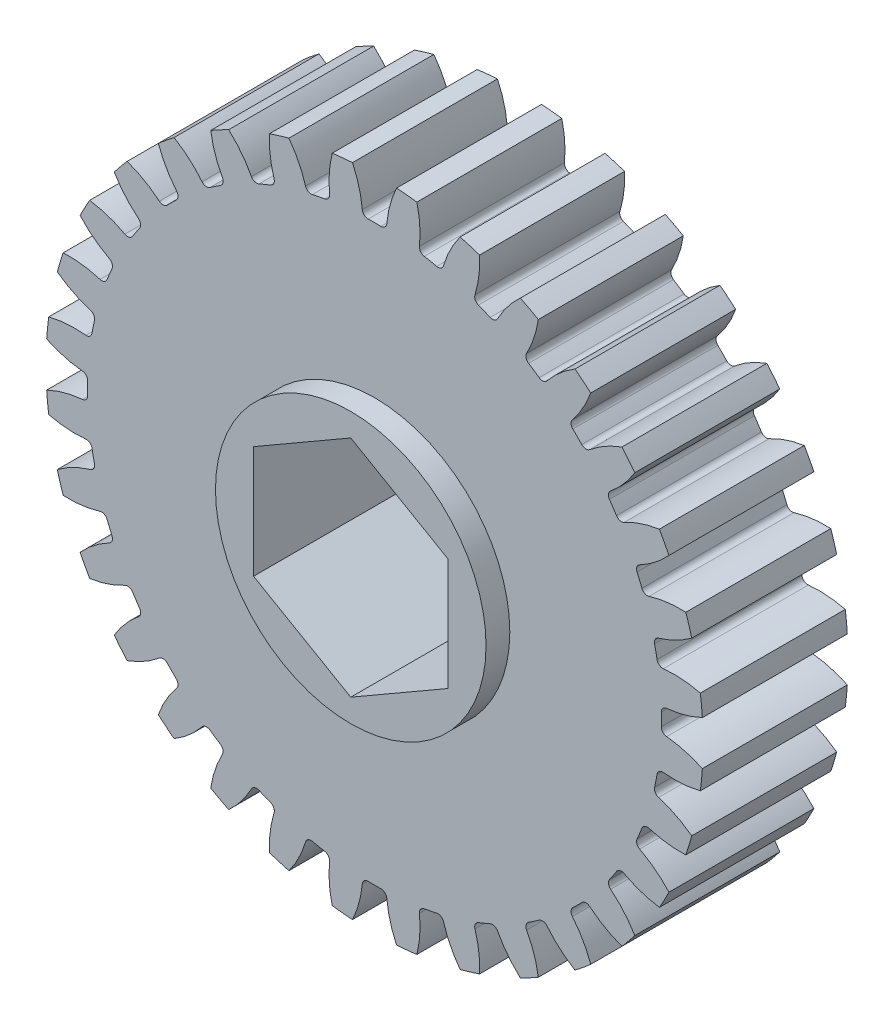
from build123d import *

# Parameters (mm, degrees)
CROQUIS1_R                 = 21.59
SALIENTE_EXTRUIR1_DEPTH    = 4.7625
CORTAR_EXTRUIR1_DEPTH      = 31.902064757
REDONDEO1_R                = 0.381028065
MATRIZC1_COUNT             = 32
REDONDEO1_OF_MATRIZC1_R    = 0.381028065
CROQUIS3_R                 = 8.89
SALIENTE_EXTRUIR2_DEPTH    = 6.3246
CORTAR_EXTRUIR2_DEPTH      = 32.113625961
CORTAR_EXTRUIR2_DEPTH_BACK = 32.113625961


with BuildPart() as part:
    # Croquis1 → Saliente-Extruir1 (new, symmetric)
    with BuildSketch(Plane.XY):
        Circle(CROQUIS1_R)
    extrude(amount=SALIENTE_EXTRUIR1_DEPTH, both=True)

    # Croquis2 → Cortar-Extruir1 (cut, symmetric)
    with BuildSketch(Plane.XY):
        with BuildLine():
            ThreePointArc((0.780357424, 18.834450872), (0, 18.85061), (-0.780357424, 18.834450872))
            ThreePointArc((-0.780357424, 18.834450872), (-0.978355848, 20.221556235), (-1.448974349, 21.54132246))
            ThreePointArc((-1.448974349, 21.54132246), (0, 21.59), (1.448974349, 21.54132246))
            ThreePointArc((1.448974349, 21.54132246), (0.978355848, 20.221556235), (0.780357424, 18.834450872))
        make_face()
    cortar_extruir1 = extrude(amount=CORTAR_EXTRUIR1_DEPTH, both=True, mode=Mode.SUBTRACT)

    # Redondeo1
    redondeo1_edges = [part.edges().sort_by_distance(p)[0] for p in [
        (0.780357424, 18.834450872, 0),
        (-0.780357424, 18.834450872, 0),
    ]]
    fillet(redondeo1_edges, radius=REDONDEO1_R)

    # MatrizC1: Cortar-Extruir1 ×32 about axis
    matrizc1_axis = Axis((0, 0, 4.7625), (0, 0, -1))
    for i in range(1, MATRIZC1_COUNT):
        add(cortar_extruir1.rotate(matrizc1_axis, i * 360 / MATRIZC1_COUNT), mode=Mode.SUBTRACT)

    # Redondeo1 of MatrizC1
    redondeo1_of_matrizc1_edges = [part.edges().sort_by_distance(p)[0] for p in [
        (4.439782161, 18.320311999, 0),
        (2.90905601, 18.624792361, 0),
        (7.928588559, 17.102133809, 0),
        (6.486676054, 17.699393525, 0),
        (11.112703745, 15.226730209, 0),
        (9.815016775, 16.093816921, 0),
        (13.869763958, 12.766171905, 0),
        (12.766171905, 13.869763958, 0),
        (16.093816921, 9.815016775, 0),
        (15.226730209, 11.112703745, 0),
        (17.699393525, 6.486676054, 0),
        (17.102133809, 7.928588559, 0),
        (18.624792361, 2.90905601, 0),
        (18.320311999, 4.439782161, 0),
        (18.834450872, -0.780357424, 0),
        (18.834450872, 0.780357424, 0),
        (18.320311999, -4.439782161, 0),
        (18.624792361, -2.90905601, 0),
        (17.102133809, -7.928588559, 0),
        (17.699393525, -6.486676054, 0),
        (15.226730209, -11.112703745, 0),
        (16.093816921, -9.815016775, 0),
        (12.766171905, -13.869763958, 0),
        (13.869763958, -12.766171905, 0),
        (9.815016775, -16.093816921, 0),
        (11.112703745, -15.226730209, 0),
        (6.486676054, -17.699393525, 0),
        (7.928588559, -17.102133809, 0),
        (2.90905601, -18.624792361, 0),
        (4.439782161, -18.320311999, 0),
        (-0.780357424, -18.834450872, 0),
        (0.780357424, -18.834450872, 0),
        (-4.439782161, -18.320311999, 0),
        (-2.90905601, -18.624792361, 0),
        (-7.928588559, -17.102133809, 0),
        (-6.486676054, -17.699393525, 0),
        (-11.112703745, -15.226730209, 0),
        (-9.815016775, -16.093816921, 0),
        (-13.869763958, -12.766171905, 0),
        (-12.766171905, -13.869763958, 0),
        (-16.093816921, -9.815016775, 0),
        (-15.226730209, -11.112703745, 0),
        (-17.699393525, -6.486676054, 0),
        (-17.102133809, -7.928588559, 0),
        (-18.624792361, -2.90905601, 0),
        (-18.320311999, -4.439782161, 0),
        (-18.834450872, 0.780357424, 0),
        (-18.834450872, -0.780357424, 0),
        (-18.320311999, 4.439782161, 0),
        (-18.624792361, 2.90905601, 0),
        (-17.102133809, 7.928588559, 0),
        (-17.699393525, 6.486676054, 0),
        (-15.226730209, 11.112703745, 0),
        (-16.093816921, 9.815016775, 0),
        (-12.766171905, 13.869763958, 0),
        (-13.869763958, 12.766171905, 0),
        (-9.815016775, 16.093816921, 0),
        (-11.112703745, 15.226730209, 0),
        (-6.486676054, 17.699393525, 0),
        (-7.928588559, 17.102133809, 0),
        (-2.90905601, 18.624792361, 0),
        (-4.439782161, 18.320311999, 0),
    ]]
    fillet(redondeo1_of_matrizc1_edges, radius=REDONDEO1_OF_MATRIZC1_R)

    # Croquis3 → Saliente-Extruir2 (add, symmetric)
    with BuildSketch(Plane.XY):
        Circle(CROQUIS3_R)
    extrude(amount=SALIENTE_EXTRUIR2_DEPTH, both=True)

    # Croquis4 → Cortar-Extruir2 (cut, two sides: drawn at the far end of the back side and taken through both)
    with BuildSketch(Plane.XY.offset(-CORTAR_EXTRUIR2_DEPTH_BACK)):
        Polygon((6.3881, 3.688171255), (0, 7.376342509), (-6.3881, 3.688171255), (-6.3881, -3.688171255), (0, -7.376342509), (6.3881, -3.688171255), align=None)
    extrude(amount=CORTAR_EXTRUIR2_DEPTH + CORTAR_EXTRUIR2_DEPTH_BACK, mode=Mode.SUBTRACT)


solid = part.part
